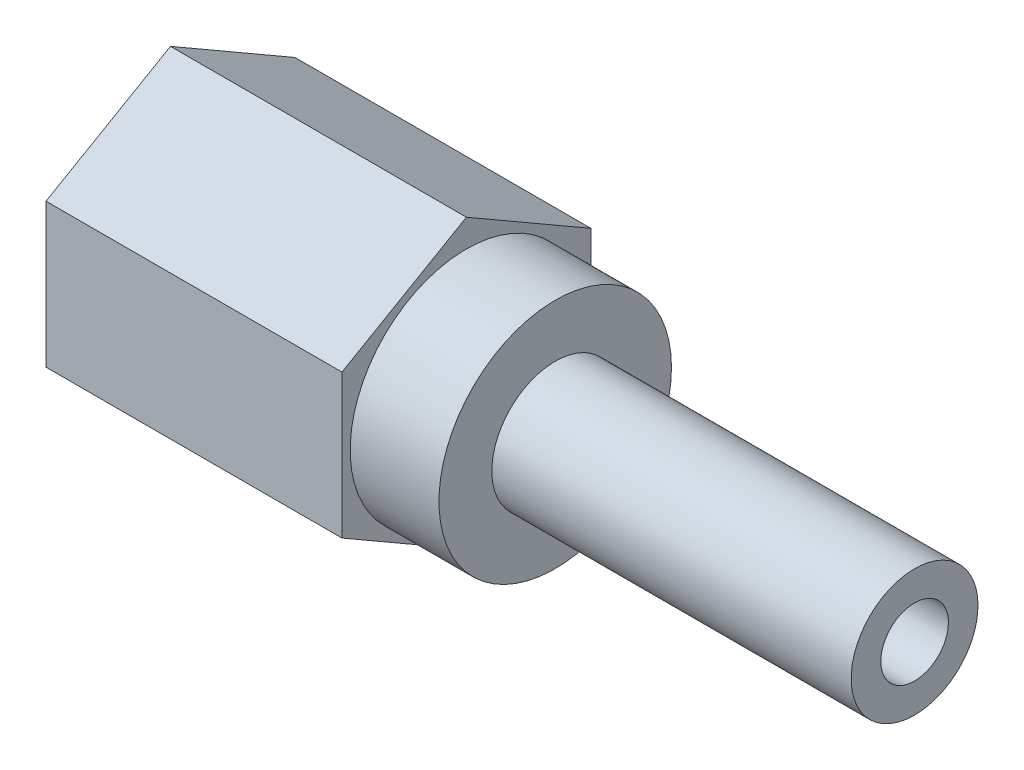
from build123d import *

# Parameters (mm, degrees)
BOSS_EXTRUDE1_DEPTH = 7
SKETCH2_R           = 2.75
BOSS_EXTRUDE2_DEPTH = 2.1
SKETCH3_R           = 1.5
BOSS_EXTRUDE3_DEPTH = 8.5
SKETCH4_R           = 1.5
CUT_EXTRUDE1_DEPTH  = 5
SKETCH5_R           = 0.8
CUT_EXTRUDE2_DEPTH  = 14.378714437


with BuildPart() as part:
    # Sketch1 → Boss-Extrude1 (new body)
    with BuildSketch(Plane.YZ):
        Polygon((3.4, 0), (1.7, 2.944486373), (-1.7, 2.944486373), (-3.4, 0), (-1.7, -2.944486373), (1.7, -2.944486373), align=None)
    extrude(amount=BOSS_EXTRUDE1_DEPTH)

    # Sketch2 → Boss-Extrude2 (add)
    with BuildSketch(Plane.YZ.offset(7)):
        with Locations(Location((0, 0, 0), (0, 0, 270))):
            Circle(SKETCH2_R)
    extrude(amount=BOSS_EXTRUDE2_DEPTH)

    # Sketch3 → Boss-Extrude3 (add)
    with BuildSketch(Plane.YZ.offset(9.1)):
        with Locations(Location((0, 0, 0), (0, 0, 270))):
            Circle(SKETCH3_R)
    extrude(amount=BOSS_EXTRUDE3_DEPTH)

    # Sketch4 → Cut-Extrude1 (cut)
    with BuildSketch(Plane(origin=(0, 0, 0), x_dir=(0, -1, 0), z_dir=(-1, 0, 0))):
        with Locations(Location((0, 0, 0), (0, 0, 270))):
            Circle(SKETCH4_R)
    extrude(amount=-CUT_EXTRUDE1_DEPTH, mode=Mode.SUBTRACT)

    # Sketch5 → Cut-Extrude2 (cut, through all)
    with BuildSketch(Plane(origin=(5, 0, 0), x_dir=(0, -1, 0), z_dir=(-1, 0, 0))):
        with Locations(Location((0, 0, 0), (0, 0, 90))):
            Circle(SKETCH5_R)
    extrude(amount=-CUT_EXTRUDE2_DEPTH, mode=Mode.SUBTRACT)


solid = part.part
